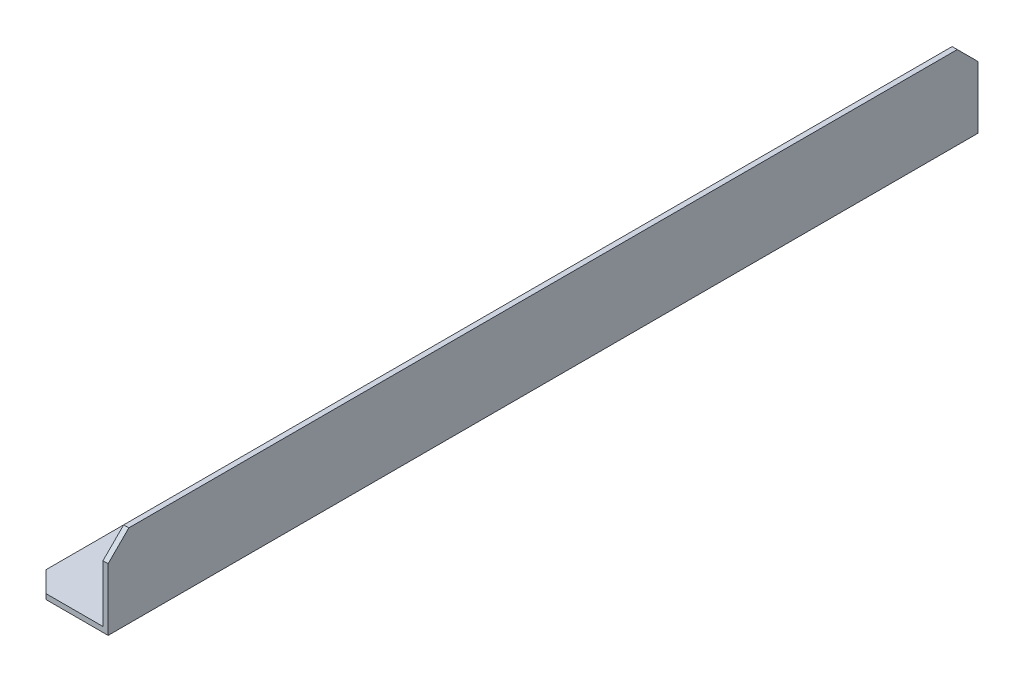
from build123d import *

# Parameters (mm, degrees)
BOSS_EXTRUDE1_DEPTH                       = 533.4
CHAMFER1_SIZE                             = 12.7
CSK_FOR_8_FLAT_HEAD_MACHINE_SCREW_2_COUNT = 2
CSK_FOR_8_FLAT_HEAD_MACHINE_SCREW_2_PITCH = 457.2
CSK_FOR_8_FLAT_HEAD_MACHINE_SCREW_3_COUNT = 2
CSK_FOR_8_FLAT_HEAD_MACHINE_SCREW_3_PITCH = 342.9
CSK_FOR_8_FLAT_HEAD_MACHINE_SCREW_4_COUNT = 2
CSK_FOR_8_FLAT_HEAD_MACHINE_SCREW_4_PITCH = 228.6
CSK_FOR_8_FLAT_HEAD_MACHINE_SCREW_5_COUNT = 2
CSK_FOR_8_FLAT_HEAD_MACHINE_SCREW_5_PITCH = 114.3


with BuildPart() as part:
    # Sketch2 → Boss-Extrude1 (new body)
    with BuildSketch(Plane.XY):
        Polygon((0, 0), (0, 50.8), (-3.175, 50.8), (-3.175, 3.175), (-50.8, 3.175), (-50.8, 0), align=None)
    extrude(amount=-BOSS_EXTRUDE1_DEPTH)

    # Chamfer1
    chamfer1_edges = [part.edges().sort_by_distance(p)[0] for p in [
        (-1.5875, 50.8, -533.4),
        (-50.8, 1.5875, -533.4),
        (-50.8, 1.5875, 0),
        (-1.5875, 50.8, 0),
    ]]
    chamfer(chamfer1_edges, length=CHAMFER1_SIZE)

    # Sketch4 → CSK for #8 Flat Head Machine Screw (100)1 (revolve, cut)
    with BuildSketch(Plane(origin=(-26.9875, 3.175, -495.3), x_dir=(0, 0, 1), z_dir=(1, 0, 0))):
        Polygon((0, 0), (0, 3.175), (2.45745, 3.175), (2.45745, 1.475934296), (4.2164, 0), align=None)
    csk_for_8_flat_head_machine_screw_100 = revolve(axis=Axis((-26.9875, 9.525, -495.3), (0, -1, 0)), mode=Mode.SUBTRACT)

    # CSK for _8 Flat Head Machine Screw _ 2: CSK for #8 Flat Head Machine Screw (100)1 ×2
    with Locations(*[(0, 0, i * CSK_FOR_8_FLAT_HEAD_MACHINE_SCREW_2_PITCH) for i in range(1, CSK_FOR_8_FLAT_HEAD_MACHINE_SCREW_2_COUNT)]):
        add(csk_for_8_flat_head_machine_screw_100, mode=Mode.SUBTRACT)

    # CSK for _8 Flat Head Machine Screw _ 3: CSK for #8 Flat Head Machine Screw (100)1 ×2
    with Locations(*[(0, 0, i * CSK_FOR_8_FLAT_HEAD_MACHINE_SCREW_3_PITCH) for i in range(1, CSK_FOR_8_FLAT_HEAD_MACHINE_SCREW_3_COUNT)]):
        add(csk_for_8_flat_head_machine_screw_100, mode=Mode.SUBTRACT)

    # CSK for _8 Flat Head Machine Screw _ 4: CSK for #8 Flat Head Machine Screw (100)1 ×2
    with Locations(*[(0, 0, i * CSK_FOR_8_FLAT_HEAD_MACHINE_SCREW_4_PITCH) for i in range(1, CSK_FOR_8_FLAT_HEAD_MACHINE_SCREW_4_COUNT)]):
        add(csk_for_8_flat_head_machine_screw_100, mode=Mode.SUBTRACT)

    # CSK for _8 Flat Head Machine Screw _ 5: CSK for #8 Flat Head Machine Screw (100)1 ×2
    with Locations(*[(0, 0, i * CSK_FOR_8_FLAT_HEAD_MACHINE_SCREW_5_PITCH) for i in range(1, CSK_FOR_8_FLAT_HEAD_MACHINE_SCREW_5_COUNT)]):
        add(csk_for_8_flat_head_machine_screw_100, mode=Mode.SUBTRACT)


solid = part.part
